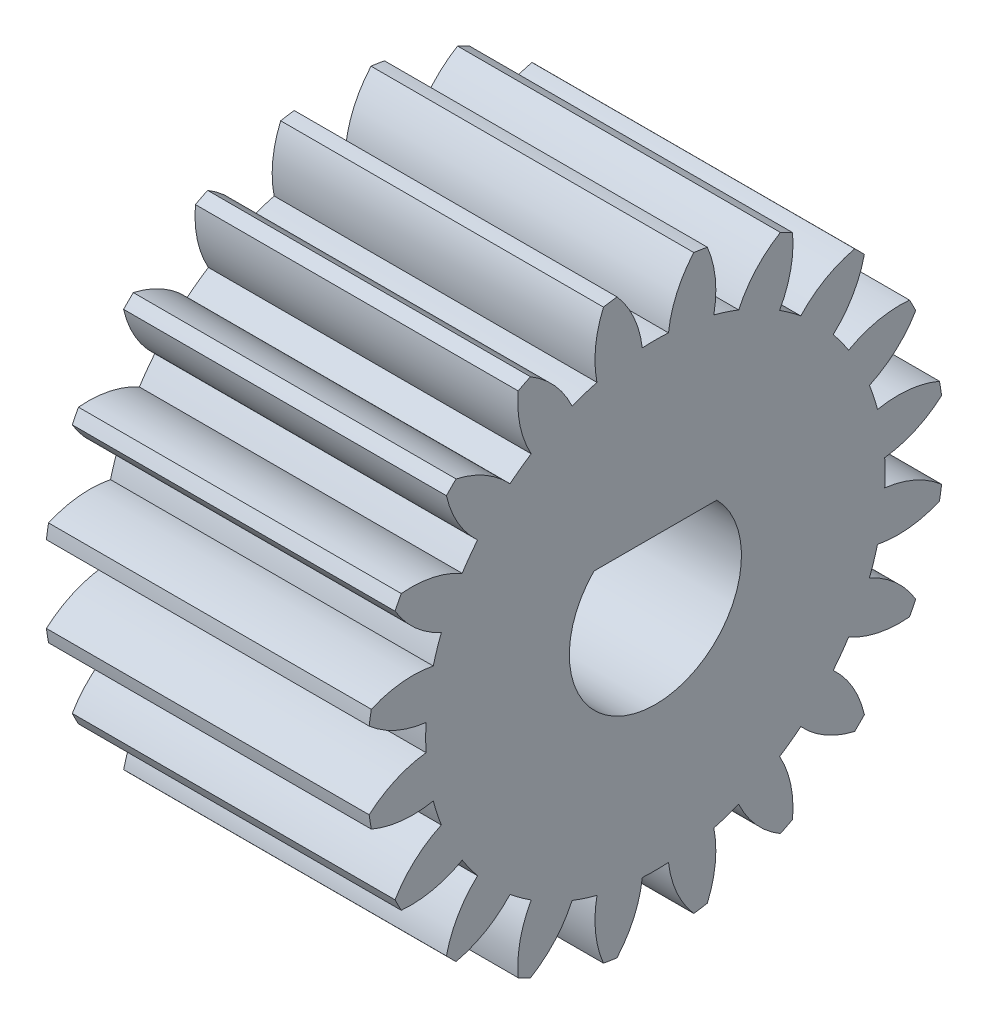
from build123d import *

# Parameters (mm, degrees)
BASPROSKE_W         = 15
BASPROSKE_H         = 13.42
TOOTHCUT_DEPTH      = 25.190758566
TEETHCUTS_COUNT     = 20
TEETHCUTS_ANGLE     = 342
BORSKE_R            = 4
BORE_DEPTH          = 50.0000508
BOSS_EXTRUDE1_START = -15
BOSS_EXTRUDE1_DEPTH = 15
SKETCH2_W           = 1.2
SKETCH2_H           = 8
CUT_EXTRUDE1_DEPTH  = 2


with BuildPart() as part:
    # BasProSke → Base-Revolve (revolve)
    with BuildSketch(Plane(origin=(0, 0, 0), x_dir=(1, 0, 0), z_dir=(0, 1, 0)), mode=Mode.PRIVATE) as base_revolve_sk:
        with Locations((7.5, 6.71)):
            Rectangle(BASPROSKE_W, BASPROSKE_H)
    revolve(base_revolve_sk.sketch.rotate(Axis((-10, 0, 0), (1, 0, 0)), 180), axis=Axis((-10, 0, 0), (1, 0, 0)))

    # TooCutSke → ToothCut (cut, through all)
    with BuildSketch(Plane(origin=(0, 0, 0), x_dir=(0, 0, -1), z_dir=(1, 0, 0))):
        with BuildLine():
            ThreePointArc((0.607848894, 10.656678456), (0, 10.674), (-0.607848894, 10.656678456))
            ThreePointArc((-0.607848894, 10.656678456), (-1.001950595, 12.081933102), (-1.804853959, 13.32371132))
            ThreePointArc((-1.804853959, 13.32371132), (0, 13.4454), (1.804853959, 13.32371132))
            ThreePointArc((1.804853959, 13.32371132), (1.001950595, 12.081933102), (0.607848894, 10.656678456))
        make_face()
    toothcut = extrude(amount=TOOTHCUT_DEPTH, mode=Mode.SUBTRACT)

    # TeethCuts: ToothCut ×20 about axis
    teethcuts_axis = Axis((-10, 0, 0), (1, 0, 0))
    for i in range(1, TEETHCUTS_COUNT):
        add(toothcut.rotate(teethcuts_axis, i * TEETHCUTS_ANGLE / (TEETHCUTS_COUNT - 1)), mode=Mode.SUBTRACT)

    # BorSke → Bore (cut, symmetric)
    with BuildSketch(Plane(origin=(0, 0, 0), x_dir=(0, 0, -1), z_dir=(1, 0, 0))):
        with Locations(Location((0, 0, 0), (0, 0, 180))):
            Circle(BORSKE_R)
    extrude(amount=BORE_DEPTH, both=True, mode=Mode.SUBTRACT)

    # Sketch1 → Boss-Extrude1 (add)
    with BuildSketch(Plane.ZY.offset(BOSS_EXTRUDE1_START)):
        with BuildLine():
            Line((-2.856571371, 2.8), (2.856571371, 2.8))
            ThreePointArc((2.856571371, 2.8), (0, 4), (-2.856571371, 2.8))
        make_face()
    extrude(amount=BOSS_EXTRUDE1_DEPTH)

    # Sketch2 → Cut-Extrude1 (cut)
    with BuildSketch(Plane.ZY):
        with Locations((-7, 0)):
            Rectangle(SKETCH2_W, SKETCH2_H)
    extrude(amount=-CUT_EXTRUDE1_DEPTH, mode=Mode.SUBTRACT)


solid = part.part
